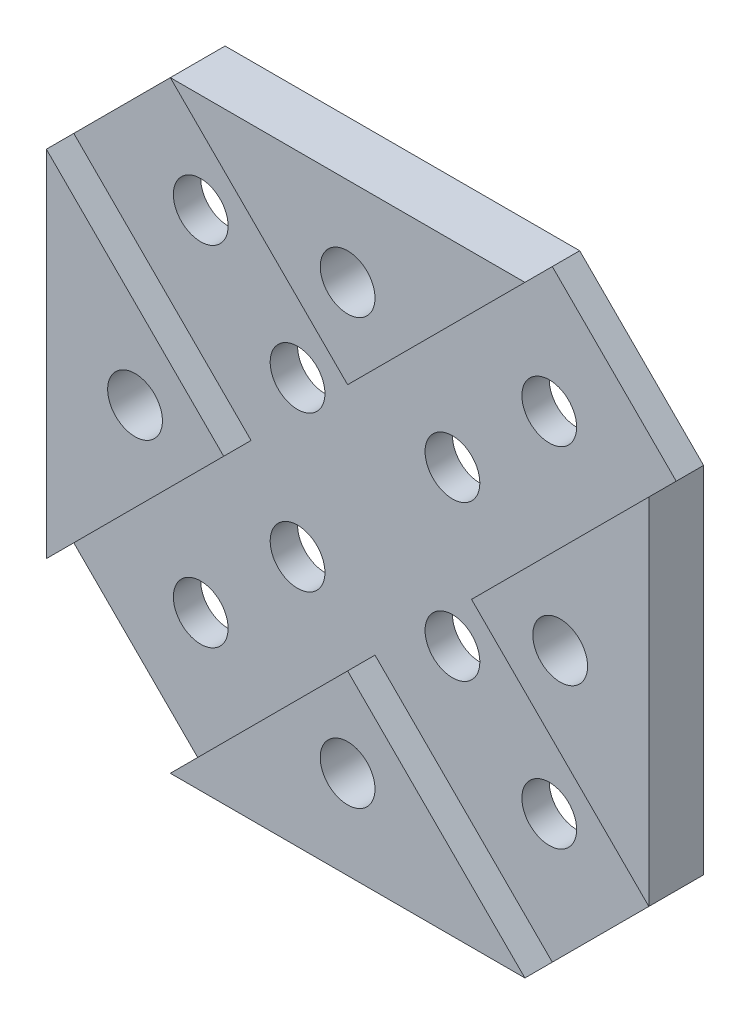
from build123d import *

# Parameters (mm, degrees)
BOSS_EXTRU_1_DEPTH           = 10
ENL_V_MAT_EXTRU_1_DEPTH      = 5
ENL_V_MAT_EXTRU_2_DEPTH      = 78.942286341
ENL_V_MAT_EXTRU_2_DEPTH_BACK = 78.942286341
ESQUISSE4_R                  = 5


with BuildPart() as part:
    # Esquisse1 → Boss.-Extru.1 (new body)
    with BuildSketch(Plane.XY):
        Polygon((-32.372583002, 55), (-55, 32.372583002), (-55, -32.372583002), (-32.372583002, -55), (32.372583002, -55), (55, -32.372583002), (55, 32.372583002), (32.372583002, 55), align=None)
    extrude(amount=BOSS_EXTRU_1_DEPTH)

    # Esquisse3 → Enlèv. mat.-Extru.1 (cut)
    with BuildSketch(Plane.XY.offset(10)):
        Polygon((-55, 32.372583002), (-32.372583002, 55), (0, 22.627416998), (32.372583002, 55), (55, 32.372583002), (22.627416998, 0), (55, -32.372583002), (32.372583002, -55), (0, -22.627416998), (-32.372583002, -55), (-55, -32.372583002), (-22.627416998, 0), align=None)
    extrude(amount=-ENL_V_MAT_EXTRU_1_DEPTH, mode=Mode.SUBTRACT)

    # Esquisse4 → Enlèv. mat.-Extru.2 (cut, two sides: drawn at the far end of the back side and taken through both)
    with BuildSketch(Plane.XY.offset(5).offset(-ENL_V_MAT_EXTRU_2_DEPTH_BACK)):
        with Locations((-31.819805153, 31.819805153)):
            Circle(ESQUISSE4_R)
        with Locations((-14.142135624, 14.142135624)):
            Circle(ESQUISSE4_R)
        with Locations((31.819805153, 31.819805153)):
            Circle(ESQUISSE4_R)
        with Locations((14.142135624, 14.142135624)):
            Circle(ESQUISSE4_R)
        with Locations((31.819805153, -31.819805153)):
            Circle(ESQUISSE4_R)
        with Locations((14.142135624, -14.142135624)):
            Circle(ESQUISSE4_R)
        with Locations((-31.819805153, -31.819805153)):
            Circle(ESQUISSE4_R)
        with Locations((-14.142135624, -14.142135624)):
            Circle(ESQUISSE4_R)
        with Locations((0, 38.813708499)):
            Circle(ESQUISSE4_R)
        with Locations((38.813708499, 0)):
            Circle(ESQUISSE4_R)
        with Locations((0, -38.813708499)):
            Circle(ESQUISSE4_R)
        with Locations((-38.813708499, 0)):
            Circle(ESQUISSE4_R)
    extrude(amount=ENL_V_MAT_EXTRU_2_DEPTH + ENL_V_MAT_EXTRU_2_DEPTH_BACK, mode=Mode.SUBTRACT)


solid = part.part
